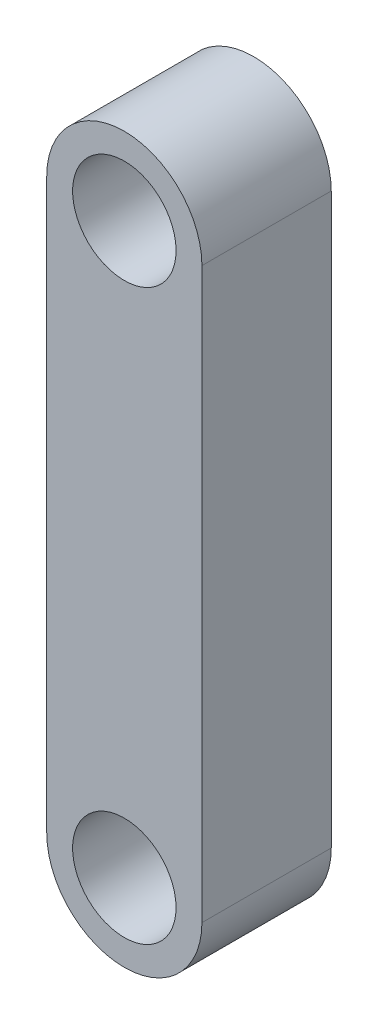
from build123d import *

# Parameters (mm, degrees)
SKETCH1_R           = 2
BOSS_EXTRUDE1_DEPTH = 5


with BuildPart() as part:
    # Sketch1 → Boss-Extrude1 (new body)
    with BuildSketch(Plane.XY):
        with BuildLine():
            Line((-1.23480663, 17.073121547), (-1.23480663, -4.926878453))
            ThreePointArc((-1.23480663, -4.926878453), (1.76519337, -7.926878453), (4.76519337, -4.926878453))
            Line((4.76519337, -4.926878453), (4.76519337, 17.073121547))
            ThreePointArc((4.76519337, 17.073121547), (1.76519337, 20.073121547), (-1.23480663, 17.073121547))
        make_face()
        with Locations((1.76519337, 17.073121547)):
            Circle(SKETCH1_R, mode=Mode.SUBTRACT)
        with Locations((1.76519337, -4.926878453)):
            Circle(SKETCH1_R, mode=Mode.SUBTRACT)
    extrude(amount=BOSS_EXTRUDE1_DEPTH)


solid = part.part
